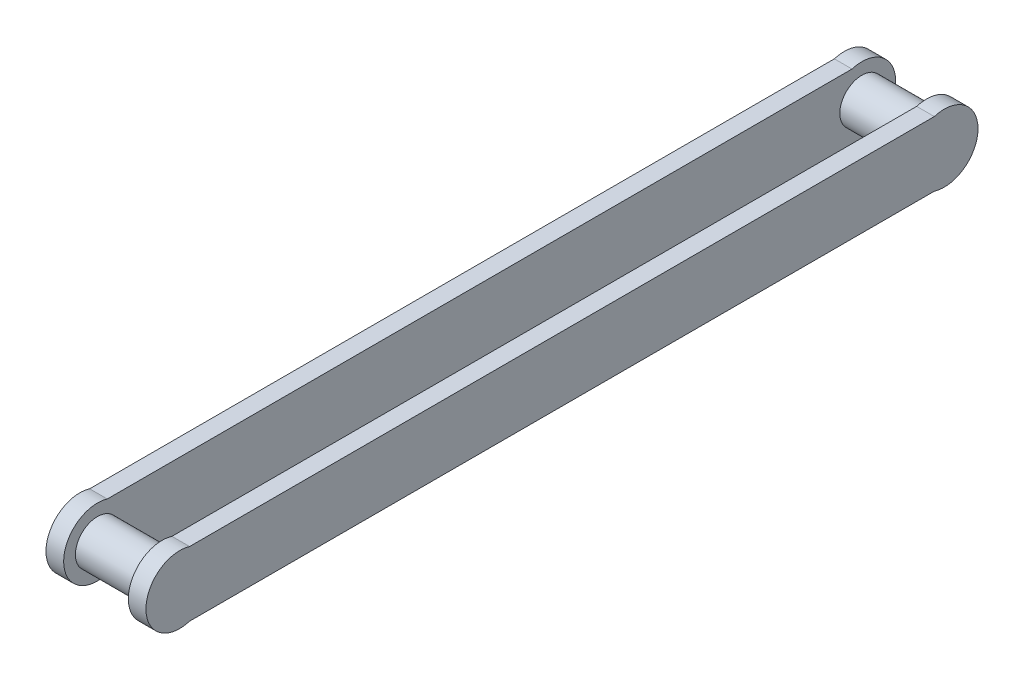
from build123d import *

# Parameters (mm, degrees)
BOSS_EXTRUDE1_DEPTH = 5.5
BOSS_EXTRUDE3_START = -3
BOSS_EXTRUDE3_DEPTH = 3


with BuildPart() as part:
    # Sketch1 → Boss-Extrude1 (new body)
    with BuildSketch(Plane(origin=(0, 0, 0), x_dir=(0, 0, -1), z_dir=(1, 0, 0))):
        with BuildLine():
            Line((-89.1719550698585, -5.9728416814886485), (-89.1719550698585, -2.2228416814886414))
            Line((-89.1719550698585, -2.2228416814886414), (-89.1719550698585, 1.5271583185113649))
            ThreePointArc((-89.17195506985841, 1.5271583185113649), (-92.9219550698585, -2.2228416814886476), (-89.1719550698584, -5.972841681488648))
        make_face()
        with BuildLine():
            Line((40.82804493014197, 1.5271583185113649), (40.82804493014197, -2.2228416814886414))
            Line((40.82804493014197, -2.2228416814886414), (40.82804493014197, -5.9728416814886485))
            ThreePointArc((40.828044930142056, -5.972841681488648), (43.47969535959156, -4.874492110938169), (44.57804493014198, -2.2228416814886423))
            ThreePointArc((44.57804493014198, -2.2228416814886414), (43.47969535959156, 0.4288087479608862), (40.828044930142056, 1.5271583185113649))
        make_face()
        with BuildLine():
            ThreePointArc((40.828044930142056, 1.5271583185113649), (38.176394500692446, 0.42880874796094703), (37.078044930141964, -2.222841681488641))
            Line((37.07804493014196, -2.2228416814886414), (40.82804493014196, -2.2228416814886414))
            Line((40.82804493014197, -2.2228416814886414), (40.82804493014197, 1.5271583185113649))
        make_face()
        with BuildLine():
            Line((40.82804493014196, -2.2228416814886414), (37.07804493014196, -2.2228416814886414))
            ThreePointArc((37.078044930141964, -2.222841681488641), (38.176394500692446, -4.874492110938229), (40.828044930142056, -5.972841681488648))
            Line((40.82804493014197, -5.9728416814886485), (40.82804493014197, -2.2228416814886414))
        make_face()
        with BuildLine():
            Line((-89.1719550698585, 1.5271583185113649), (-89.1719550698585, -2.2228416814886414))
            Line((-89.1719550698585, -2.2228416814886414), (-85.4219550698585, -2.2228416814886414))
            ThreePointArc((-85.4219550698585, -2.2228416814886414), (-86.52030464040891, 0.4288087479608862), (-89.17195506985841, 1.5271583185113649))
        make_face()
        with BuildLine():
            Line((-85.4219550698585, -2.2228416814886414), (-89.1719550698585, -2.2228416814886414))
            Line((-89.1719550698585, -2.2228416814886414), (-89.1719550698585, -5.9728416814886485))
            ThreePointArc((-89.1719550698584, -5.972841681488648), (-86.52030464040891, -4.874492110938164), (-85.4219550698585, -2.2228416814886423))
        make_face()
    boss_extrude1 = extrude(amount=BOSS_EXTRUDE1_DEPTH)

    # Sketch1<4> → Boss-Extrude3 (add)
    with BuildSketch(Plane(origin=(0, 0, 0), x_dir=(0, 0, -1), z_dir=(1, 0, 0)).offset(BOSS_EXTRUDE3_START)):
        with BuildLine():
            Line((35.078044930141985, -2.2228416814886414), (-83.42195506985851, -2.2228416814886414))
            ThreePointArc((-83.42195506985851, -2.2228416814886427), (-84.55104914390795, -5.6447897266107425), (-87.49490408673329, -7.722841681488518))
            Line((-87.49490408673327, -7.722841681488641), (39.150993947017625, -7.722841681488641))
            ThreePointArc((39.1509939470176, -7.72284168148878), (36.207139004191674, -5.644789726611098), (35.07804493014198, -2.2228416814886405))
        make_face()
        with BuildLine():
            ThreePointArc((-87.49490408673329, 3.277158318511235), (-84.55104914390795, 1.1991063636334598), (-83.42195506985851, -2.2228416814886414))
            Line((-83.42195506985851, -2.2228416814886414), (35.078044930141985, -2.2228416814886414))
            ThreePointArc((35.07804493014198, -2.2228416814886405), (36.207139004191674, 1.1991063636338088), (39.150993947017575, 3.27715831851149))
            Line((39.1509939470176, 3.2771583185113586), (-87.49490408673327, 3.2771583185113586))
        make_face()
        with BuildLine():
            ThreePointArc((-89.17195506985841, 1.5271583185113649), (-86.52030464040891, 0.4288087479608862), (-85.4219550698585, -2.2228416814886414))
            Line((-85.4219550698585, -2.2228416814886414), (-83.42195506985851, -2.2228416814886414))
            ThreePointArc((-83.42195506985851, -2.2228416814886414), (-84.55104914390795, 1.1991063636334598), (-87.49490408673329, 3.277158318511235))
            Line((-87.49490408673327, 3.2771583185113586), (-89.1719550698585, 3.2771583185113586))
            Line((-89.1719550698585, 3.2771583185113586), (-89.1719550698585, 1.5271583185113649))
        make_face()
        with BuildLine():
            Line((-83.42195506985851, -2.2228416814886414), (-85.4219550698585, -2.2228416814886414))
            ThreePointArc((-85.4219550698585, -2.2228416814886423), (-86.52030464040891, -4.874492110938164), (-89.1719550698584, -5.972841681488648))
            Line((-89.1719550698585, -5.9728416814886485), (-89.1719550698585, -7.722841681488641))
            Line((-89.1719550698585, -7.722841681488641), (-87.49490408673327, -7.722841681488641))
            ThreePointArc((-87.49490408673329, -7.722841681488518), (-84.55104914390795, -5.6447897266107425), (-83.42195506985851, -2.2228416814886427))
        make_face()
        with BuildLine():
            Line((-89.1719550698585, -5.9728416814886485), (-89.1719550698585, -2.2228416814886414))
            Line((-89.1719550698585, -2.2228416814886414), (-89.1719550698585, 1.5271583185113649))
            ThreePointArc((-89.17195506985841, 1.5271583185113649), (-92.9219550698585, -2.2228416814886476), (-89.1719550698584, -5.972841681488648))
        make_face()
        with BuildLine():
            Line((-89.1719550698585, 1.5271583185113649), (-89.1719550698585, -2.2228416814886414))
            Line((-89.1719550698585, -2.2228416814886414), (-85.4219550698585, -2.2228416814886414))
            ThreePointArc((-85.4219550698585, -2.2228416814886414), (-86.52030464040891, 0.4288087479608862), (-89.17195506985841, 1.5271583185113649))
        make_face()
        with BuildLine():
            Line((-85.4219550698585, -2.2228416814886414), (-89.1719550698585, -2.2228416814886414))
            Line((-89.1719550698585, -2.2228416814886414), (-89.1719550698585, -5.9728416814886485))
            ThreePointArc((-89.1719550698584, -5.972841681488648), (-86.52030464040891, -4.874492110938164), (-85.4219550698585, -2.2228416814886423))
        make_face()
        with BuildLine():
            ThreePointArc((-89.1719550698584, -5.972841681488648), (-92.9219550698585, -2.2228416814886476), (-89.17195506985841, 1.5271583185113649))
            Line((-89.1719550698585, 1.5271583185113649), (-89.1719550698585, 3.2771583185113586))
            Line((-89.1719550698585, 3.2771583185113586), (-87.49490408673327, 3.2771583185113586))
            ThreePointArc((-87.49490408673329, 3.277158318511235), (-94.92195506985848, -2.2228416814886405), (-87.49490408673329, -7.722841681488518))
            Line((-87.49490408673327, -7.722841681488641), (-89.1719550698585, -7.722841681488641))
            Line((-89.1719550698585, -7.722841681488641), (-89.1719550698585, -5.9728416814886485))
        make_face()
        with BuildLine():
            Line((40.82804493014197, 1.5271583185113649), (40.82804493014197, -2.2228416814886414))
            Line((40.82804493014197, -2.2228416814886414), (40.82804493014197, -5.9728416814886485))
            ThreePointArc((40.828044930142056, -5.972841681488648), (43.47969535959156, -4.874492110938169), (44.57804493014198, -2.2228416814886423))
            ThreePointArc((44.57804493014198, -2.2228416814886414), (43.47969535959156, 0.4288087479608862), (40.828044930142056, 1.5271583185113649))
        make_face()
        with BuildLine():
            ThreePointArc((40.828044930142056, 1.5271583185113649), (38.176394500692446, 0.42880874796094703), (37.078044930141964, -2.222841681488641))
            Line((37.07804493014196, -2.2228416814886414), (40.82804493014196, -2.2228416814886414))
            Line((40.82804493014197, -2.2228416814886414), (40.82804493014197, 1.5271583185113649))
        make_face()
        with BuildLine():
            Line((40.82804493014196, -2.2228416814886414), (37.07804493014196, -2.2228416814886414))
            ThreePointArc((37.078044930141964, -2.222841681488641), (38.176394500692446, -4.874492110938229), (40.828044930142056, -5.972841681488648))
            Line((40.82804493014197, -5.9728416814886485), (40.82804493014197, -2.2228416814886414))
        make_face()
        with BuildLine():
            ThreePointArc((39.150993947017575, 3.27715831851149), (36.207139004191674, 1.1991063636338088), (35.07804493014198, -2.2228416814886405))
            Line((35.078044930141985, -2.2228416814886414), (37.07804493014196, -2.2228416814886414))
            ThreePointArc((37.078044930141964, -2.222841681488641), (38.176394500692446, 0.42880874796094703), (40.828044930142056, 1.5271583185113649))
            Line((40.82804493014197, 1.5271583185113649), (40.82804493014197, 3.2771583185113586))
            Line((40.82804493014196, 3.2771583185113586), (39.1509939470176, 3.2771583185113586))
        make_face()
        with BuildLine():
            ThreePointArc((46.578044930141964, -2.2228416814886414), (44.24999297526442, 2.3980642444616596), (39.150993947017575, 3.27715831851149))
            Line((39.1509939470176, 3.2771583185113586), (40.82804493014196, 3.2771583185113586))
            Line((40.82804493014197, 3.2771583185113586), (40.82804493014197, 1.5271583185113649))
            ThreePointArc((40.828044930142056, 1.5271583185113649), (43.47969535959156, 0.4288087479608862), (44.57804493014198, -2.2228416814886414))
            ThreePointArc((44.57804493014198, -2.2228416814886423), (43.47969535959156, -4.874492110938169), (40.828044930142056, -5.972841681488648))
            Line((40.82804493014197, -5.9728416814886485), (40.82804493014197, -7.722841681488641))
            Line((40.82804493014196, -7.722841681488641), (39.150993947017625, -7.722841681488641))
            ThreePointArc((39.1509939470176, -7.72284168148878), (44.249992975264426, -6.843747607438935), (46.578044930141964, -2.2228416814886427))
        make_face()
        with BuildLine():
            Line((37.07804493014196, -2.2228416814886414), (35.078044930141985, -2.2228416814886414))
            ThreePointArc((35.07804493014198, -2.2228416814886405), (36.207139004191674, -5.644789726611098), (39.1509939470176, -7.72284168148878))
            Line((39.150993947017625, -7.722841681488641), (40.82804493014196, -7.722841681488641))
            Line((40.82804493014197, -7.722841681488641), (40.82804493014197, -5.9728416814886485))
            ThreePointArc((40.828044930142056, -5.972841681488648), (38.176394500692446, -4.874492110938229), (37.078044930141964, -2.222841681488641))
        make_face()
    boss_extrude3 = extrude(amount=BOSS_EXTRUDE3_DEPTH)

    # Mirror1: Boss-Extrude1, Boss-Extrude3 across plane
    add(boss_extrude1.mirror(Plane(origin=(5.5, 0, 0), x_dir=(0, 0, 1), z_dir=(1, 0, 0))))
    add(boss_extrude3.mirror(Plane(origin=(5.5, 0, 0), x_dir=(0, 0, 1), z_dir=(1, 0, 0))))


solid = part.part
